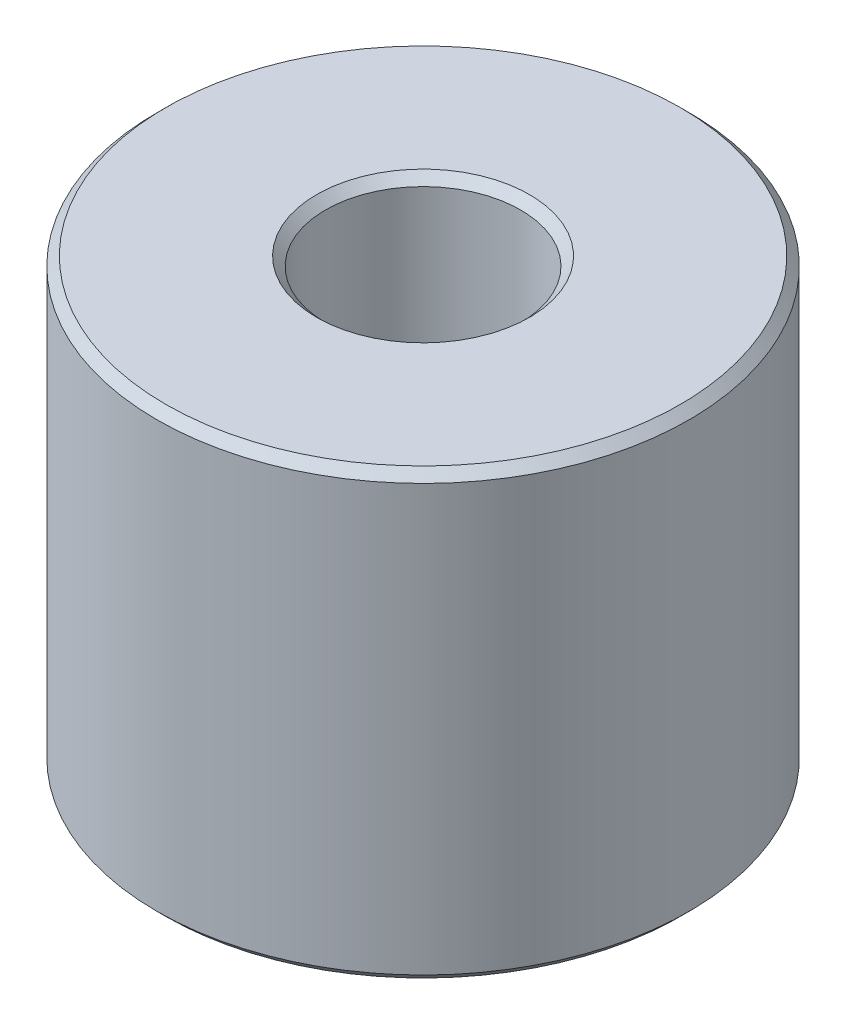
from build123d import *

# Parameters (mm, degrees)
SKETCH_1_R      = 3
SKETCH_1_R_2    = 1.1
EXTRUDE_1_DEPTH = 2.5
CHAMFER_1_SIZE  = 0.1


with BuildPart() as part:
    # ｽｹｯﾁ1 → ﾎﾞｽ - 押し出し1 (new, symmetric)
    with BuildSketch(Plane(origin=(0, 0, 0), x_dir=(1, 0, 0), z_dir=(0, 1, 0))):
        with Locations(Location((0, 0, 0), (0, 0, 270))):
            Circle(SKETCH_1_R)
        with Locations(Location((0, 0, 0), (0, 0, 270))):
            Circle(SKETCH_1_R_2, mode=Mode.SUBTRACT)
    extrude(amount=EXTRUDE_1_DEPTH, both=True)

    # 面取り1
    chamfer_1_edges = [part.edges().sort_by_distance(p)[0] for p in [
        (0, -2.5, -3),
        (0, 2.5, -3),
        (0, -2.5, -1.1),
        (0, 2.5, -1.1),
    ]]
    chamfer(chamfer_1_edges, length=CHAMFER_1_SIZE)


solid = part.part
